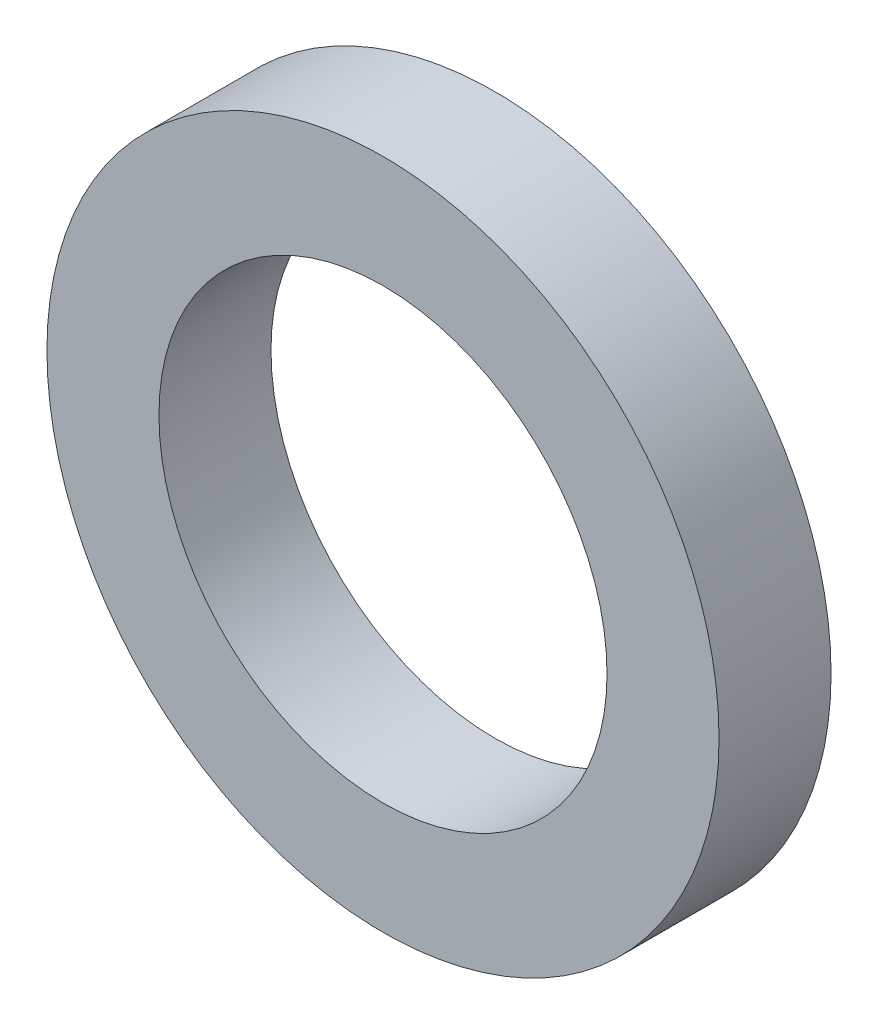
from build123d import *

# Parameters (mm, degrees)
SKETCH1_W = 7
SKETCH1_H = 7


with BuildPart() as part:
    # Sketch1 → REV_Radial_Seal_28x42x7_envelope (revolve)
    with BuildSketch(Plane(origin=(0, 0, 0), x_dir=(1, 0, 0), z_dir=(0, 1, 0))):
        with Locations((17.5, 100.5)):
            Rectangle(SKETCH1_W, SKETCH1_H)
    revolve(axis=Axis((0, 0, 150), (0, 0, -1)))


solid = part.part
